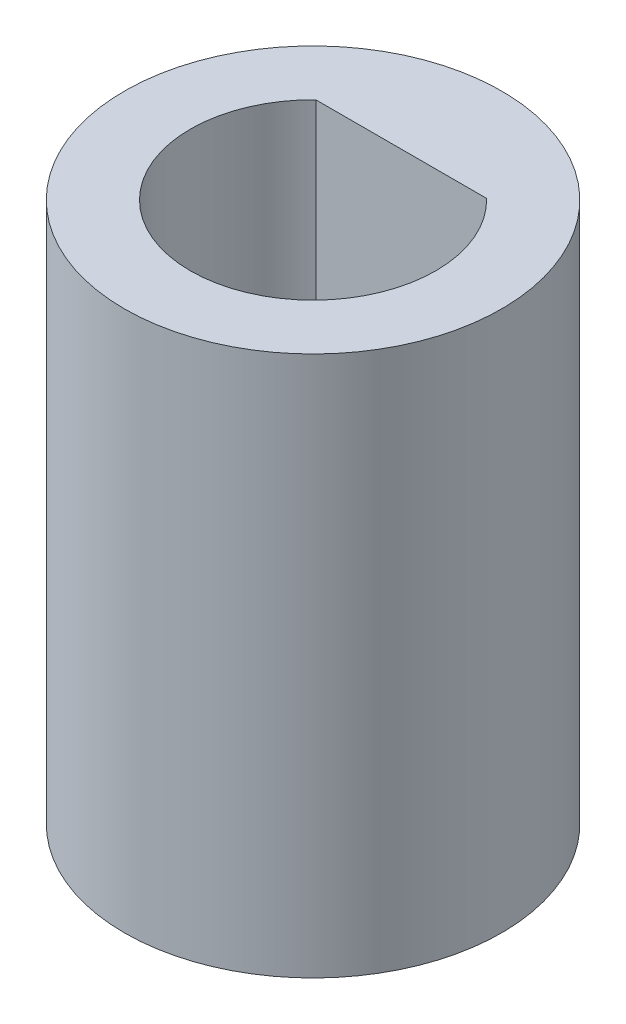
from build123d import *

# Parameters (mm, degrees)
SKETCH1_R           = 5.725
BOSS_EXTRUDE1_DEPTH = 16.4
CUT_EXTRUDE1_DEPTH  = 19.289648712


with BuildPart() as part:
    # Sketch1 → Boss-Extrude1 (new body)
    with BuildSketch(Plane(origin=(0, 0, 0), x_dir=(1, 0, 0), z_dir=(0, 1, 0))):
        with Locations(Location((0, 0, 0), (0, 0, 270))):
            Circle(SKETCH1_R)
    extrude(amount=-BOSS_EXTRUDE1_DEPTH)

    # Sketch3 → Cut-Extrude1 (cut, through all)
    with BuildSketch(Plane(origin=(0, 0, 0), x_dir=(1, 0, 0), z_dir=(0, 1, 0))):
        with BuildLine():
            Line((-2.592296279, 2.675), (2.592296279, 2.675))
            ThreePointArc((2.592296279, 2.675), (0, -3.725), (-2.592296279, 2.675))
        make_face()
    extrude(amount=-CUT_EXTRUDE1_DEPTH, mode=Mode.SUBTRACT)


solid = part.part
